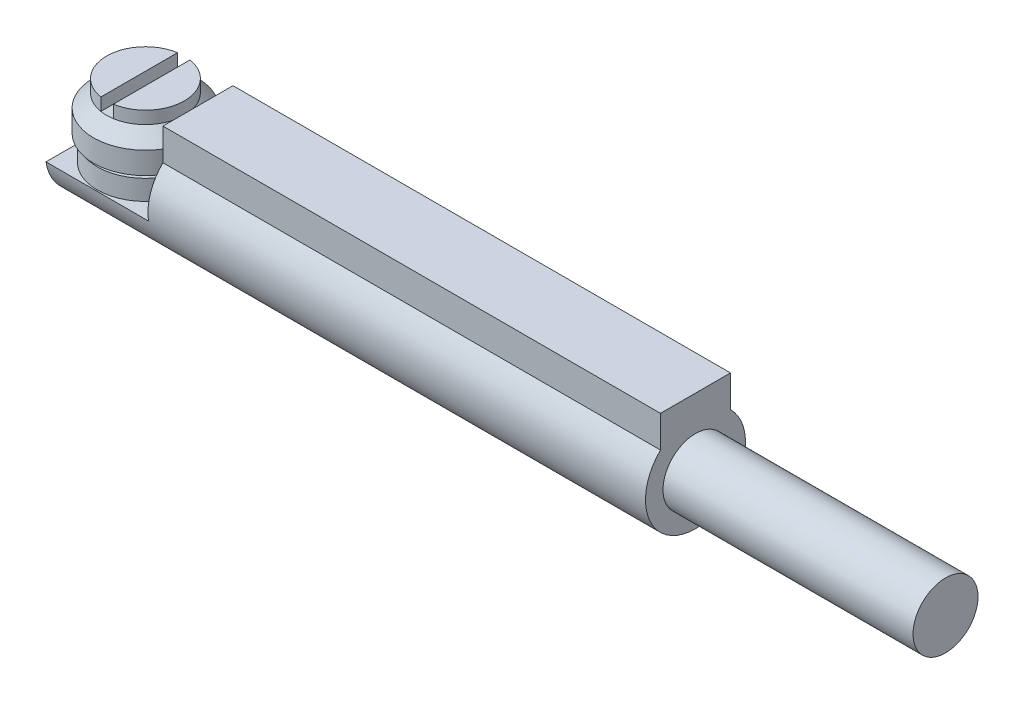
from build123d import *

# Parameters (mm, degrees)
BOSS_EXTRUDE1_DEPTH = 24
SKETCH2_W           = 8.2
SKETCH2_H           = 5
CUT_EXTRUDE1_DEPTH  = 3
SKETCH4_W           = 0.5
SKETCH4_H           = 5
CUT_EXTRUDE2_DEPTH  = 0.5
SKETCH5_R           = 1.3
BOSS_EXTRUDE2_DEPTH = 10


with BuildPart() as part:
    # Sketch1 → Boss-Extrude1 (new body)
    with BuildSketch(Plane(origin=(0, 0, 0), x_dir=(0, 0, -1), z_dir=(1, 0, 0))):
        with BuildLine():
            Line((-1.4, 2.7), (1.4, 2.7))
            Line((1.4, 2.7), (1.4, 1.428285686))
            ThreePointArc((1.4, 1.428285686), (0, -2), (-1.4, 1.428285686))
            Line((-1.4, 1.428285686), (-1.4, 2.7))
        make_face()
    extrude(amount=BOSS_EXTRUDE1_DEPTH)

    # Sketch2 → Cut-Extrude1 (cut)
    with BuildSketch(Plane(origin=(0, 2.7, 0), x_dir=(1, 0, 0), z_dir=(0, 1, 0))):
        Rectangle(SKETCH2_W, SKETCH2_H)
    extrude(amount=-CUT_EXTRUDE1_DEPTH, mode=Mode.SUBTRACT)

    # Sketch3 → Revolve1 (revolve)
    with BuildSketch(Plane.XY):
        Polygon((0.074999, 0.499998), (1.224998, 0.499998), (1.224998, 0.7), (-0.075005, 0.7), (-0.075005, 1.58), (0.445, 2.099999), (0.445, 2.599999), (2, 2.599999), (2, -0.3), (0.074999, -0.3), align=None)
    revolve(axis=Axis((2, 2.599999, 0), (0, -1, 0)))

    # Sketch4 → Cut-Extrude2 (cut)
    with BuildSketch(Plane(origin=(0, 2.599999, 0), x_dir=(1, 0, 0), z_dir=(0, 1, 0))):
        with Locations((2, 0)):
            Rectangle(SKETCH4_W, SKETCH4_H)
    extrude(amount=-CUT_EXTRUDE2_DEPTH, mode=Mode.SUBTRACT)

    # Sketch5 → Boss-Extrude2 (add)
    with BuildSketch(Plane(origin=(24, 0, 0), x_dir=(0, 0, -1), z_dir=(1, 0, 0))):
        Circle(SKETCH5_R)
    extrude(amount=BOSS_EXTRUDE2_DEPTH)


solid = part.part
